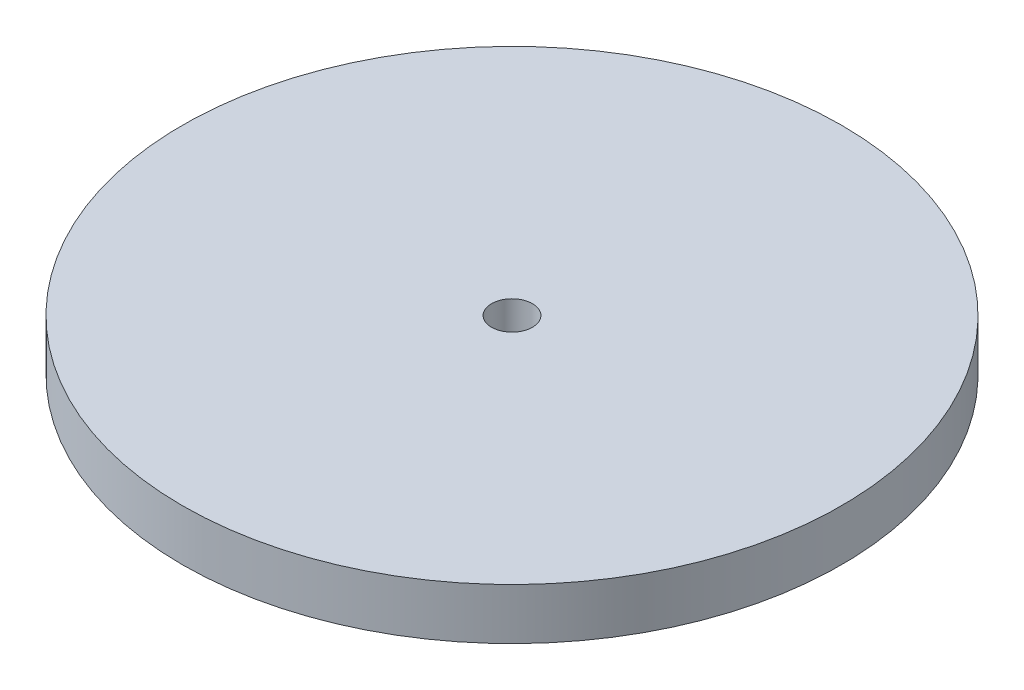
from build123d import *

# Parameters (mm, degrees)
SKETCH1_R           = 32.2
SKETCH1_R_2         = 2
BOSS_EXTRUDE1_DEPTH = 5


with BuildPart() as part:
    # Sketch1 → Boss-Extrude1 (new body)
    with BuildSketch(Plane(origin=(0, 0, 0), x_dir=(1, 0, 0), z_dir=(0, 1, 0))):
        with Locations(Location((0, 0, 0), (0, 0, 270))):
            Circle(SKETCH1_R)
        with Locations(Location((0, 0, 0), (0, 0, 270))):
            Circle(SKETCH1_R_2, mode=Mode.SUBTRACT)
    extrude(amount=BOSS_EXTRUDE1_DEPTH)


solid = part.part
